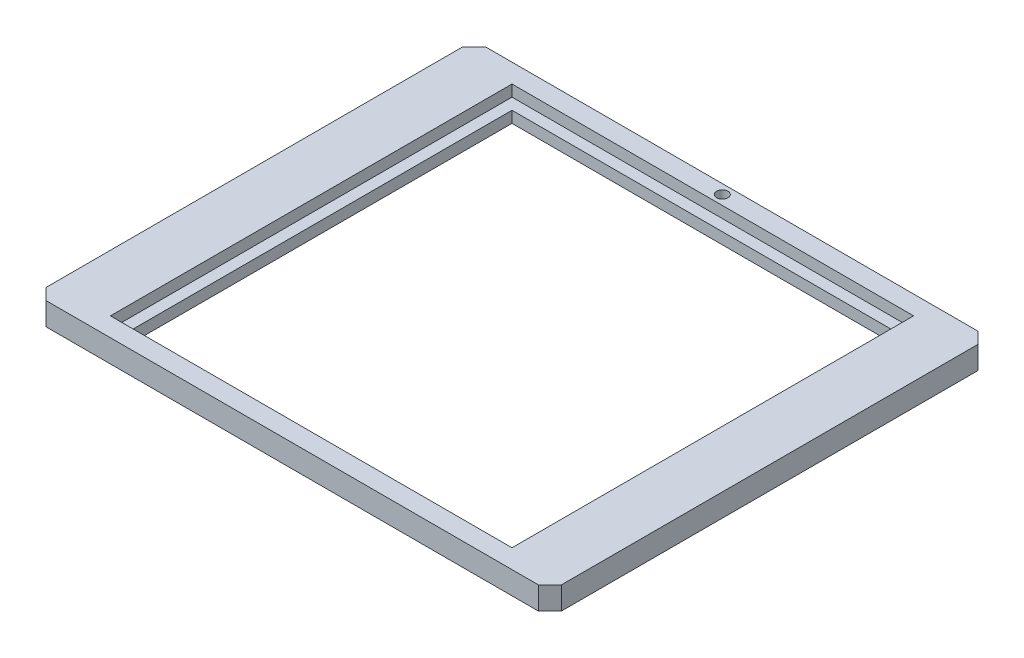
from build123d import *

# Parameters (mm, degrees)
SKETCH_3_W          = 136
SKETCH_3_H          = 116
EXTRUDE_2_DEPTH     = 6
SKETCH_4_W          = 106
SKETCH_4_H          = 106
CUT_EXTRUDE_1_DEPTH = 3
SKETCH_5_W          = 100
SKETCH_5_H          = 100
CUT_EXTRUDE_2_DEPTH = 10
CHAMFER_1_SIZE      = 3
SKETCH_6_R          = 1.5
CUT_EXTRUDE_3_DEPTH = 10


with BuildPart() as part:
    # 스케치3 → 보스-돌출2 (new body)
    with BuildSketch(Plane(origin=(0, 0, 0), x_dir=(1, 0, 0), z_dir=(0, 1, 0))):
        Rectangle(SKETCH_3_W, SKETCH_3_H)
    extrude(amount=EXTRUDE_2_DEPTH)

    # 스케치4 → 컷-돌출1 (cut)
    with BuildSketch(Plane(origin=(0, 6, 0), x_dir=(1, 0, 0), z_dir=(0, 1, 0))):
        Rectangle(SKETCH_4_W, SKETCH_4_H)
    extrude(amount=-CUT_EXTRUDE_1_DEPTH, mode=Mode.SUBTRACT)

    # 스케치5 → 컷-돌출2 (cut)
    with BuildSketch(Plane(origin=(0, 3, 0), x_dir=(1, 0, 0), z_dir=(0, 1, 0))):
        Rectangle(SKETCH_5_W, SKETCH_5_H)
    extrude(amount=-CUT_EXTRUDE_2_DEPTH, mode=Mode.SUBTRACT)

    # 모따기1
    chamfer_1_edges = [part.edges().sort_by_distance(p)[0] for p in [
        (68, 3, 58),
        (-68, 3, 58),
        (-68, 3, -58),
        (68, 3, -58),
    ]]
    chamfer(chamfer_1_edges, length=CHAMFER_1_SIZE)

    # 스케치6 → 컷-돌출3 (cut)
    with BuildSketch(Plane(origin=(0, 6, 0), x_dir=(1, 0, 0), z_dir=(0, 1, 0))):
        with Locations(Location((0, 55.5, 0), (0, 0, 270))):
            Circle(SKETCH_6_R)
    extrude(amount=-CUT_EXTRUDE_3_DEPTH, mode=Mode.SUBTRACT)


solid = part.part
